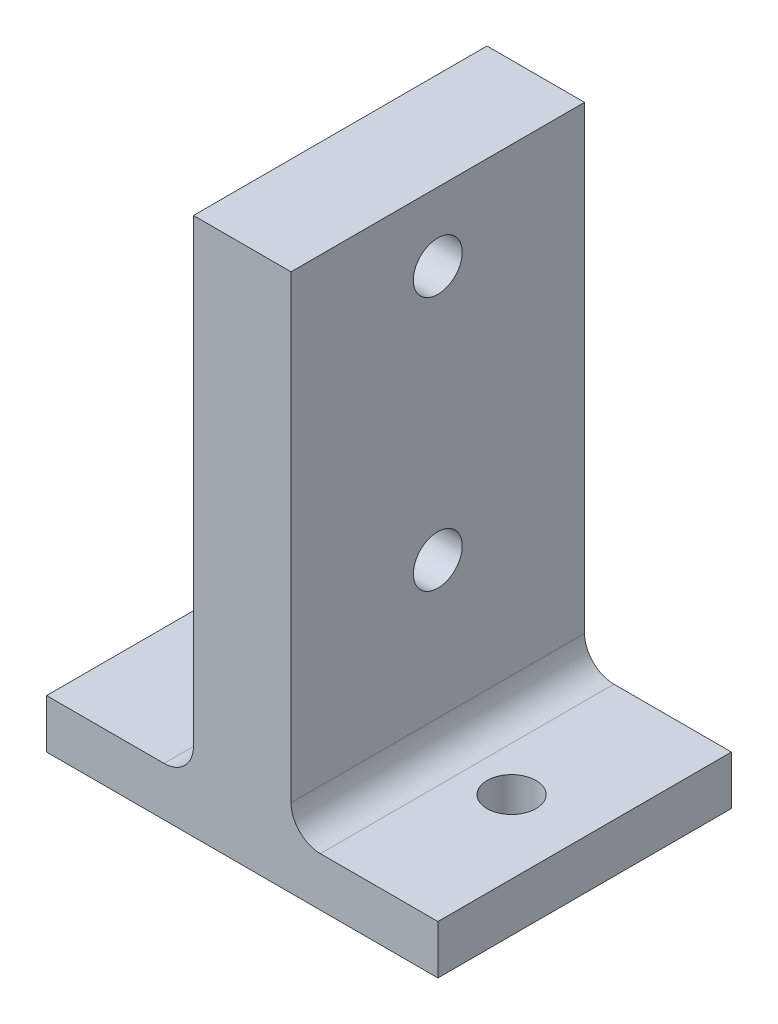
from build123d import *

# Parameters (mm, degrees)
SKETCH1_W           = 40
SKETCH1_H           = 30
BOSS_EXTRUDE1_DEPTH = 5
SKETCH2_W           = 9.972415548
SKETCH2_H           = 30
BOSS_EXTRUDE2_DEPTH = 50
SKETCH3_R           = 2.5
CUT_EXTRUDE1_DEPTH  = 56.901699437
CUT_EXTRUDE2_REACH  = 64.244
SKETCH5_R           = 2.5
FILLET1_R           = 3


with BuildPart() as part:
    # Sketch1 → Boss-Extrude1 (new body)
    with BuildSketch(Plane(origin=(0, 0, 0), x_dir=(1, 0, 0), z_dir=(0, 1, 0))):
        Rectangle(SKETCH1_W, SKETCH1_H)
    extrude(amount=BOSS_EXTRUDE1_DEPTH)

    # Sketch2 → Boss-Extrude2 (add)
    with BuildSketch(Plane(origin=(0, 5, 0), x_dir=(1, 0, 0), z_dir=(0, 1, 0))):
        Rectangle(SKETCH2_W, SKETCH2_H)
    extrude(amount=BOSS_EXTRUDE2_DEPTH)

    # Sketch3 → Cut-Extrude1 (cut, through all)
    with BuildSketch(Plane(origin=(0, 5, 0), x_dir=(1, 0, 0), z_dir=(0, 1, 0))):
        with Locations(Location((-12.525769612, 0, 0), (0, 0, 270))):
            Circle(SKETCH3_R)
        with Locations(Location((12.525769612, 0, 0), (0, 0, 270))):
            Circle(SKETCH3_R)
    extrude(amount=-CUT_EXTRUDE1_DEPTH, mode=Mode.SUBTRACT)

    # Sketch5 → Cut-Extrude2 (cut, up to next)
    with BuildSketch(Plane.ZY.offset(4.986207774), mode=Mode.PRIVATE) as cut_extrude2_sk1:
        with Locations((0, 48)):
            Circle(SKETCH5_R)
    cut_extrude2_tool1 = extrude(cut_extrude2_sk1.sketch, amount=-CUT_EXTRUDE2_REACH, mode=Mode.PRIVATE) & part.part
    # Sketch5 → Cut-Extrude2 (cut, up to next)
    with BuildSketch(Plane.ZY.offset(4.986207774), mode=Mode.PRIVATE) as cut_extrude2_sk2:
        with Locations((0, 22)):
            Circle(SKETCH5_R)
    cut_extrude2_tool2 = extrude(cut_extrude2_sk2.sketch, amount=-CUT_EXTRUDE2_REACH, mode=Mode.PRIVATE) & part.part
    add(cut_extrude2_tool1.solids().sort_by_distance((-4.986208, 48, 0))[0], mode=Mode.SUBTRACT)
    add(cut_extrude2_tool2.solids().sort_by_distance((-4.986208, 22, 0))[0], mode=Mode.SUBTRACT)

    # Fillet1
    fillet1_edges = [part.edges().sort_by_distance(p)[0] for p in [
        (4.986207774, 5, 0),
        (-4.986207774, 5, 0),
    ]]
    fillet(fillet1_edges, radius=FILLET1_R)


solid = part.part
